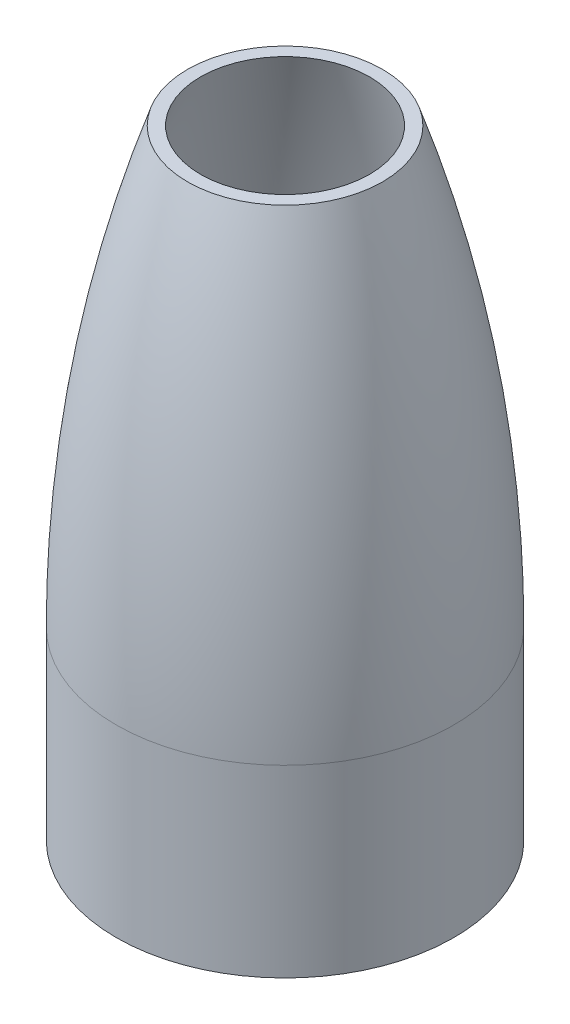
from build123d import *


with BuildPart() as part:
    # Sketch1 → Revolve1 (revolve)
    with BuildSketch(Plane.XY, mode=Mode.PRIVATE) as revolve1_sk:
        with BuildLine():
            Line((13.768174758, 62.099236364), (15.88, 62.099236364))
            ThreePointArc((15.88, 62.099236364), (24.575696287, 27.172849229), (27.5, -8.700763636))
            Line((27.5, -8.700763636), (27.5, -38.700763636))
            Line((27.5, -38.700763636), (25.5, -38.700763636))
            Line((25.5, -38.700763636), (25.5, -36.700763636))
            Line((25.5, -36.700763636), (25.5, -8.700763636))
            ThreePointArc((25.5, -8.700763636), (22.547182358, 27.181947115), (13.768174758, 62.099236364))
        make_face()
    revolve(revolve1_sk.sketch.rotate(Axis((0, 62.099236364, 0), (0, -1, 0)), 90), axis=Axis((0, 62.099236364, 0), (0, -1, 0)))


solid = part.part
